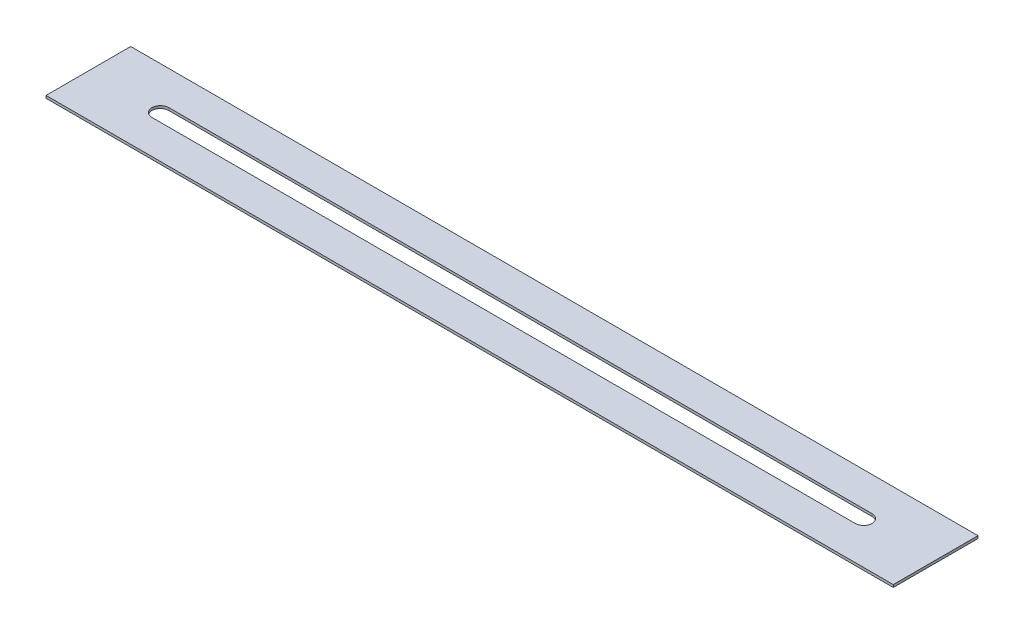
from build123d import *

# Parameters (mm, degrees)
SKETCH1_W           = 1000
SKETCH1_H           = 100
BOSS_EXTRUDE2_DEPTH = 3


with BuildPart() as part:
    # Sketch1 → Boss-Extrude2 (new body)
    with BuildSketch(Plane(origin=(0, 0, 0), x_dir=(1, 0, 0), z_dir=(0, 1, 0))):
        Rectangle(SKETCH1_W, SKETCH1_H)
        with BuildLine():
            Line((-415, 10), (415, 10))
            ThreePointArc((415, 10), (425, 0), (415, -10))
            Line((415, -10), (-415, -10))
            ThreePointArc((-415, -10), (-425, 0), (-415, 10))
        make_face(mode=Mode.SUBTRACT)
    extrude(amount=BOSS_EXTRUDE2_DEPTH)


solid = part.part
